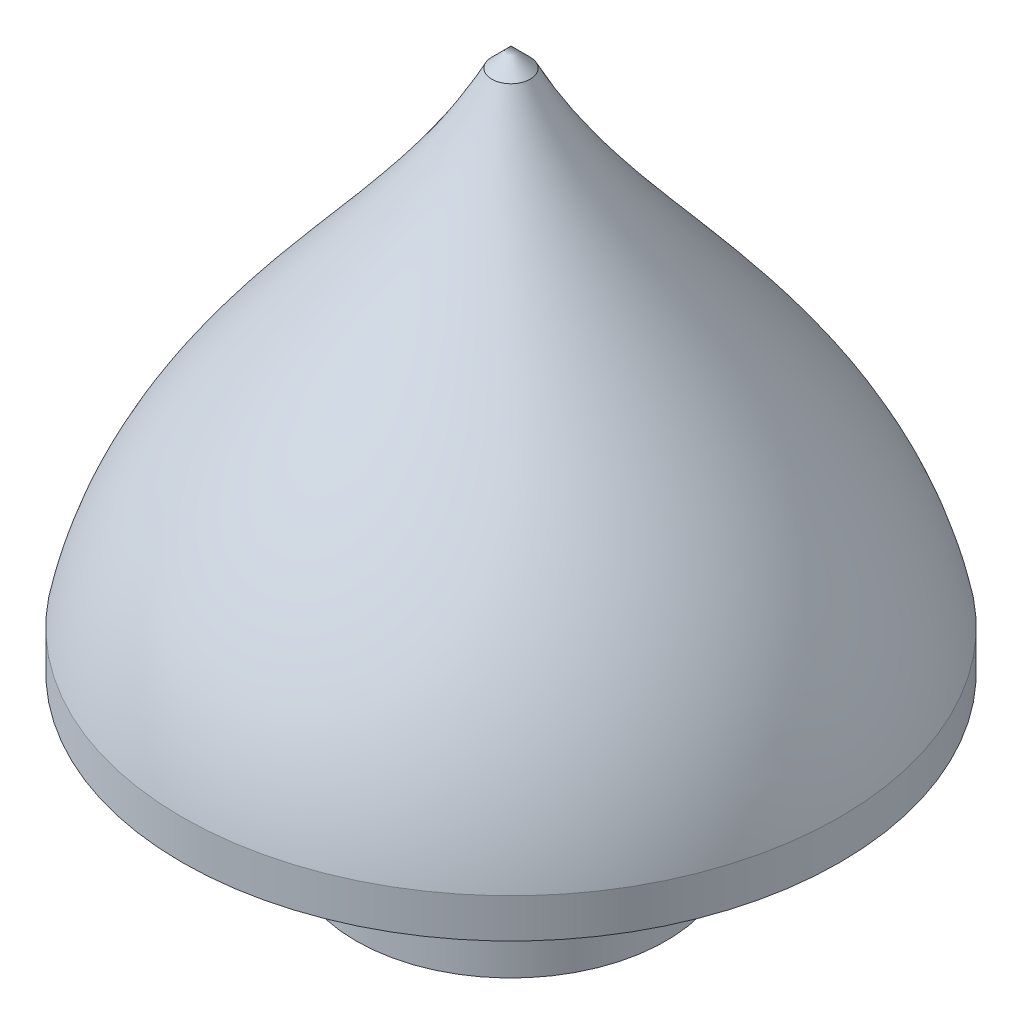
from build123d import *


with BuildPart() as part:
    # Sketch1 → Revolve1 (revolve)
    with BuildSketch(Plane.XY, mode=Mode.PRIVATE) as revolve1_sk:
        with BuildLine():
            Line((0, -2), (-2, -2))
            Line((-2, -2), (-2, 0))
            Line((-2, 0), (-4.244331573, 0))
            Line((-4.244331573, 0), (-4.244331573, 0.506327417))
            add(Edge.make_bspline(
                [(-0.247423506, 6.752576494), (-1.377312336, 4.51509098), (-3.697274955, 3.081898919), (-4.244331573, 0.506327417)],
                knots=[0, 0, 0, 0, 1, 1, 1, 1], degree=3))
            Line((-0.247423506, 6.752576494), (0, 7))
            Line((0, 7), (0, -2))
        make_face()
    revolve(revolve1_sk.sketch.rotate(Axis((0, -2, 0), (0, 1, 0)), 270), axis=Axis((0, -2, 0), (0, 1, 0)))


solid = part.part
